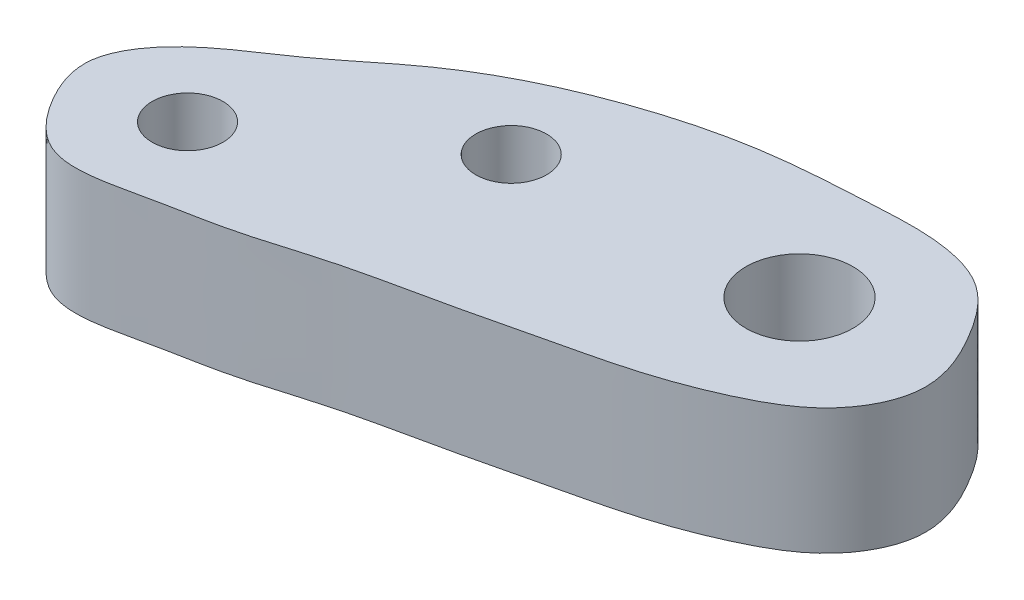
from build123d import *

# Parameters (mm, degrees)
SKETCH1_R           = 1.7
SKETCH1_R_2         = 1.125
BOSS_EXTRUDE2_DEPTH = 4


with BuildPart() as part:
    # Sketch1 → Boss-Extrude2 (new body)
    with BuildSketch(Plane(origin=(0, 0, 0), x_dir=(1, 0, 0), z_dir=(0, 1, 0))):
        with BuildLine():
            add(Edge.make_bspline(
                [(-20.223665823, 41.345797589), (-19.51353317, 42.207158648), (-17.693596198, 43.214317022), (-14.998684072, 45.596697249), (-11.556324702, 47.255467785), (-7.834195926, 48.232379185), (-4.968301938, 48.372594041), (-2.667944924, 48.504241335), (-0.625287208, 48.116947197), (0.746870917, 46.296870071), (1.723430224, 44.153866714), (0.545307675, 41.984071242), (-1.457468468, 40.832155715), (-3.676691304, 40.017156724), (-6.154262694, 39.477614231), (-8.756218686, 38.820792256), (-11.3934475, 38.318859044), (-13.929099261, 37.472596788), (-16.349803012, 37.086690088), (-18.962975701, 36.385703027), (-20.492629164, 38.165325626), (-21.162807223, 39.904309893), (-20.554623507, 40.944359829), (-20.223665823, 41.345797589)],
                knots=[0, 0, 0, 0, 0.060776693, 0.11520764, 0.200384389, 0.271360644, 0.329362157, 0.359804806, 0.401542217, 0.437503693, 0.483669777, 0.523382131, 0.561539941, 0.611495012, 0.655146264, 0.703229791, 0.761510927, 0.805502422, 0.851029337, 0.903259501, 0.937734295, 0.971674991, 1, 1, 1, 1], degree=3))
        make_face()
        with Locations(Location((-3.11530838, 44.686036761, 0), (0, 0, 270))):
            Circle(SKETCH1_R, mode=Mode.SUBTRACT)
        with Locations(Location((-11.631337248, 44.042722822, 0), (0, 0, 270))):
            Circle(SKETCH1_R_2, mode=Mode.SUBTRACT)
        with Locations(Location((-17.668644027, 39.797690803, 0), (0, 0, 270))):
            Circle(SKETCH1_R_2, mode=Mode.SUBTRACT)
    extrude(amount=BOSS_EXTRUDE2_DEPTH)


solid = part.part
